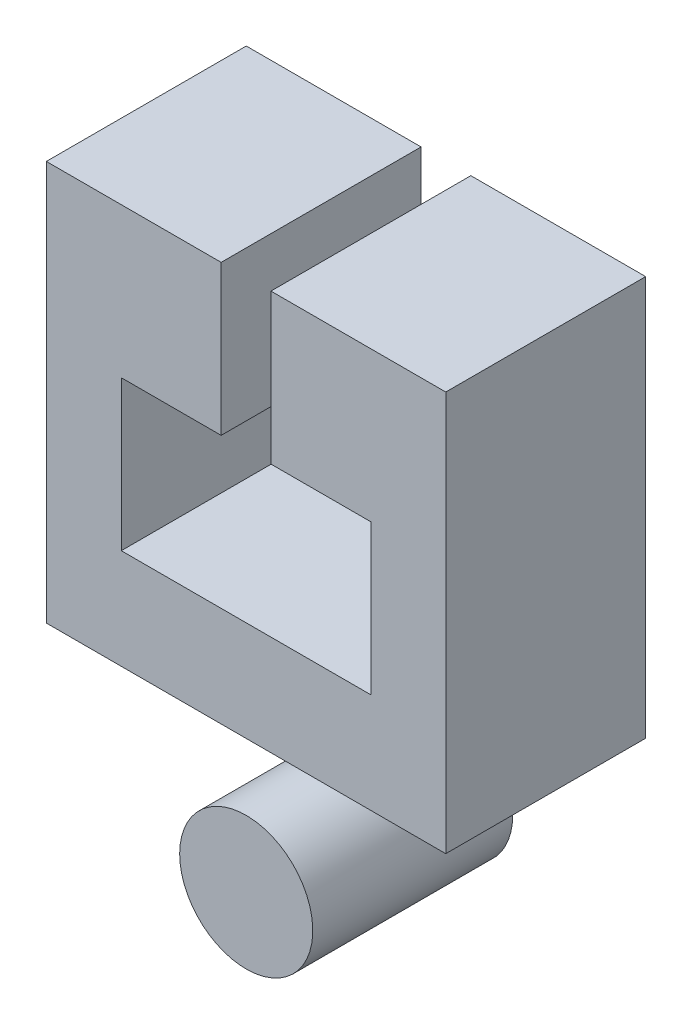
from build123d import *

# Parameters (mm, degrees)
SKETCH4_W           = 50.7492
SKETCH4_H           = 101.6
BOSS_EXTRUDE2_DEPTH = 50.8
CUT_EXTRUDE2_DEPTH  = 125.413348563
SKETCH7_W           = 33.8328
SKETCH7_H           = 33.8328
BOSS_EXTRUDE3_DEPTH = 0.5588
SKETCH8_R           = 16.9164
BOSS_EXTRUDE4_DEPTH = 50.8


with BuildPart() as part:
    # Sketch4 → Boss-Extrude2 (new body)
    with BuildSketch(Plane.XY):
        with Locations((-25.3746, 50.8)):
            Rectangle(SKETCH4_W, SKETCH4_H)
        with Locations((25.3746, 50.8)):
            Rectangle(SKETCH4_W, SKETCH4_H)
    extrude(amount=-BOSS_EXTRUDE2_DEPTH)

    # Sketch5 → Cut-Extrude2 (cut, through all)
    with BuildSketch(Plane.XY):
        Polygon((-6.3246, 101.6), (6.3246, 101.6), (6.3246, 63.5254), (31.70428, 63.5254), (31.70428, 25.4508), (-31.70428, 25.4508), (-31.70428, 63.5254), (-6.3246, 63.5254), align=None)
    extrude(amount=-CUT_EXTRUDE2_DEPTH, mode=Mode.SUBTRACT)

    # Sketch7 → Boss-Extrude3 (add)
    with BuildSketch(Plane(origin=(0, 0, -50.8), x_dir=(-1, 0, 0), z_dir=(0, 0, -1))):
        with Locations((-0.043435031, -16.9164)):
            Rectangle(SKETCH7_W, SKETCH7_H)
    extrude(amount=-BOSS_EXTRUDE3_DEPTH)

    # Sketch8 → Boss-Extrude4 (add)
    with BuildSketch(Plane(origin=(0, 0, -50.8), x_dir=(-1, 0, 0), z_dir=(0, 0, -1))):
        with Locations((-0.043435031, -33.8328)):
            Circle(SKETCH8_R)
    extrude(amount=-BOSS_EXTRUDE4_DEPTH)


solid = part.part
